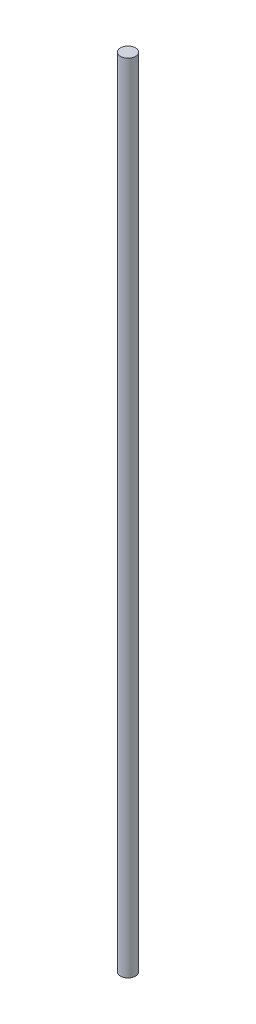
from build123d import *

# Parameters (mm, degrees)
SKETCH_1_R      = 0.75
EXTRUDE_1_DEPTH = 80


with BuildPart() as part:
    # 草图1 → 凸台-拉伸1 (new body)
    with BuildSketch(Plane(origin=(0, 0, 0), x_dir=(1, 0, 0), z_dir=(0, 1, 0))):
        with Locations(Location((0, 0, 0), (0, 0, 270))):
            Circle(SKETCH_1_R)
    extrude(amount=EXTRUDE_1_DEPTH)


solid = part.part
